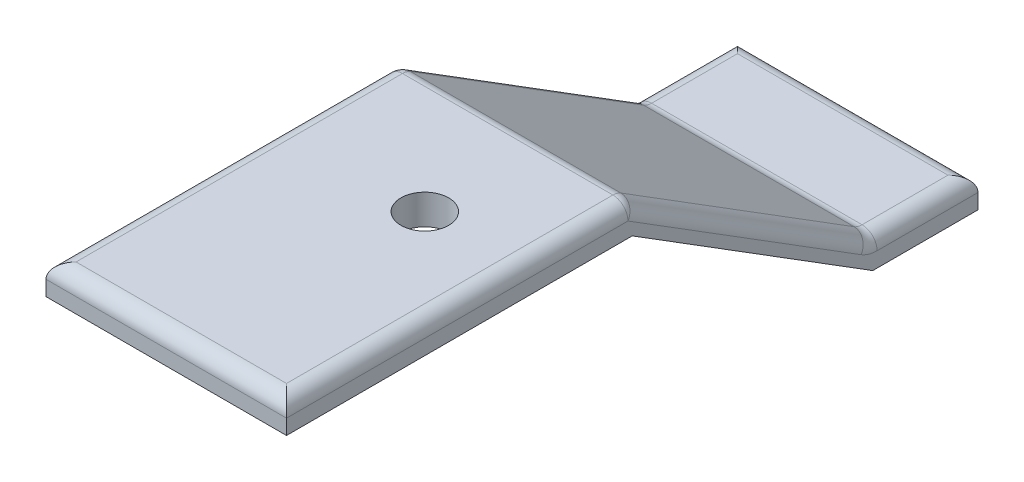
from build123d import *

# Parameters (mm, degrees)
SKETCH1_W           = 32
SKETCH1_H           = 92
BOSS_EXTRUDE1_DEPTH = 4
SKETCH2_R           = 3.175
CUT_EXTRUDE1_DEPTH  = 4
BOSS_EXTRUDE2_DEPTH = 32
CUT_EXTRUDE3_DEPTH  = 100.438423157
FILLET1_R           = 2


with BuildPart() as part:
    # Sketch1 → Boss-Extrude1 (new body)
    with BuildSketch(Plane(origin=(0, 0, 0), x_dir=(1, 0, 0), z_dir=(0, 1, 0))):
        with Locations((16, 46)):
            Rectangle(SKETCH1_W, SKETCH1_H)
    extrude(amount=BOSS_EXTRUDE1_DEPTH)

    # Sketch2 → Cut-Extrude1 (cut)
    with BuildSketch(Plane(origin=(0, 4, 0), x_dir=(1, 0, 0), z_dir=(0, 1, 0))):
        with Locations(Location((19.4, 31, 0), (0, 0, 270))):
            Circle(SKETCH2_R)
    extrude(amount=-CUT_EXTRUDE1_DEPTH, mode=Mode.SUBTRACT)

    # Sketch4 → Boss-Extrude2 (add)
    with BuildSketch(Plane(origin=(32, 0, 0), x_dir=(0, 0, -1), z_dir=(1, 0, 0))):
        Polygon((52.4, 0), (46, 0), (78, -20), (92, -20), (92, -16), (78, -16), align=None)
        Polygon((46, 4), (46, 0), (52.4, 0), align=None)
    extrude(amount=-BOSS_EXTRUDE2_DEPTH)

    # Sketch6 → Cut-Extrude3 (cut, through all)
    with BuildSketch(Plane(origin=(32, 0, 0), x_dir=(0, 0, -1), z_dir=(1, 0, 0))):
        Polygon((52.4, 0), (46, 4), (92, 4), (92, 0), align=None)
    extrude(amount=-CUT_EXTRUDE3_DEPTH, mode=Mode.SUBTRACT)

    # Fillet1
    fillet1_edges = [part.edges().sort_by_distance(p)[0] for p in [
        (32, 4, -23),
        (32, -16, -85),
        (16, -16, -78),
        (16, -16, -92),
        (32, -6, -62),
        (0, -6, -62),
        (0, -16, -85),
        (0, 4, -23),
        (16, 4, -46),
        (16, 4, 0),
    ]]
    fillet(fillet1_edges, radius=FILLET1_R)


solid = part.part
